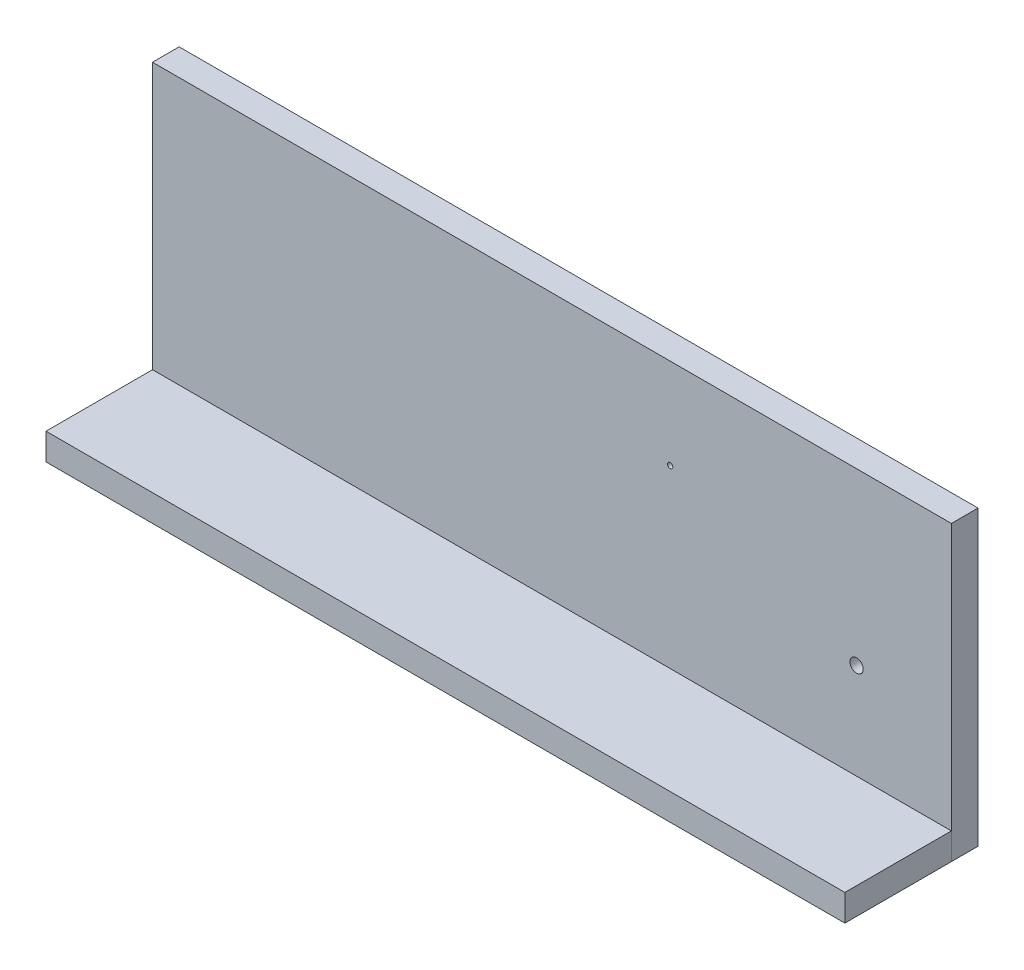
from build123d import *

# Parameters (mm, degrees)
SKETCH1_W           = 1500
SKETCH1_H           = 550
BOSS_EXTRUDE1_DEPTH = 50
SKETCH2_W           = 1500
SKETCH2_H           = 50
BOSS_EXTRUDE2_DEPTH = 200
SKETCH3_R           = 12.5
SKETCH3_R_2         = 5
CUT_EXTRUDE1_DEPTH  = 1611.12421881


with BuildPart() as part:
    # Sketch1 → Boss-Extrude1 (new body)
    with BuildSketch(Plane.XY):
        with Locations((750, 275)):
            Rectangle(SKETCH1_W, SKETCH1_H)
    extrude(amount=-BOSS_EXTRUDE1_DEPTH)

    # Sketch3 → Cut-Extrude1 (cut, through all)
    with BuildSketch(Plane.XY):
        with Locations((1322, 230)):
            Circle(SKETCH3_R)
        with Locations((972, 380)):
            Circle(SKETCH3_R_2)
    extrude(amount=-CUT_EXTRUDE1_DEPTH, mode=Mode.SUBTRACT)


with BuildPart() as body_2:
    # Sketch2 → Boss-Extrude2 (new body)
    with BuildSketch(Plane.XY):
        with Locations((750, 25)):
            Rectangle(SKETCH2_W, SKETCH2_H)
    extrude(amount=BOSS_EXTRUDE2_DEPTH)


solid = Compound([part.part, body_2.part])
